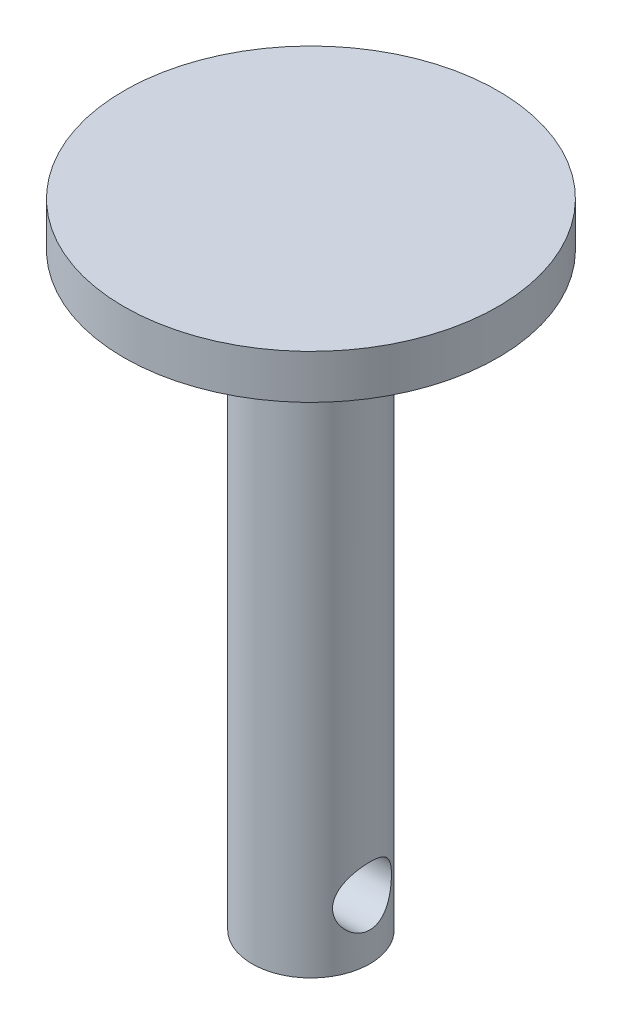
from build123d import *

# Parameters (mm, degrees)
CROQUIS1_R              = 12.7
SALIENTE_EXTRUIR1_DEPTH = 3
CROQUIS2_R              = 4
SALIENTE_EXTRUIR2_DEPTH = 40
CROQUIS4_R              = 2
CORTAR_EXTRUIR1_DEPTH   = 10


with BuildPart() as part:
    # Croquis1 → Saliente-Extruir1 (new body)
    with BuildSketch(Plane(origin=(0, 0, 0), x_dir=(1, 0, 0), z_dir=(0, 1, 0))):
        with Locations(Location((0, 0, 0), (0, 0, 270))):
            Circle(CROQUIS1_R)
    extrude(amount=SALIENTE_EXTRUIR1_DEPTH)

    # Croquis2 → Saliente-Extruir2 (add)
    with BuildSketch(Plane.XZ):
        with Locations(Location((0, 0, 0), (0, 0, 270))):
            Circle(CROQUIS2_R)
    extrude(amount=SALIENTE_EXTRUIR2_DEPTH)

    # Croquis4 → Cortar-Extruir1 (cut)
    with BuildSketch(Plane(origin=(4, 0, 0), x_dir=(0, 0, -1), z_dir=(1, 0, 0))):
        with Locations((0, -36)):
            Circle(CROQUIS4_R)
    extrude(amount=-CORTAR_EXTRUIR1_DEPTH, mode=Mode.SUBTRACT)


solid = part.part
